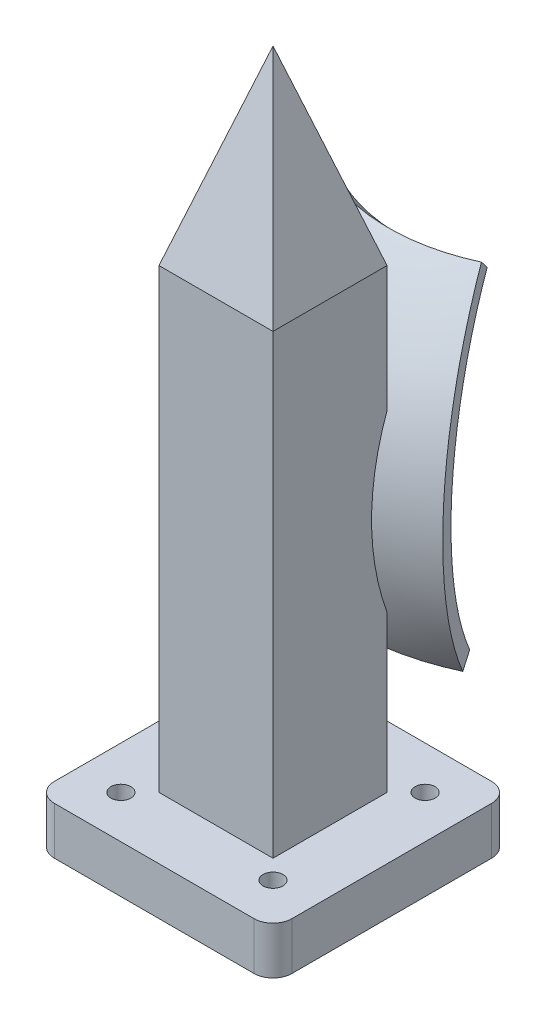
from build123d import *

# Parameters (mm, degrees)
SKETCH1_W                = 25
SKETCH1_H                = 25
BOSS_EXTRUDE1_DEPTH      = 5
SKETCH2_R                = 1.05
CUT_EXTRUDE1_DEPTH       = 5
FILLET1_R                = 2
SKETCH3_W                = 12
SKETCH3_H                = 12
SKETCH3_W_2              = 6
SKETCH3_H_2              = 6
BOSS_EXTRUDE2_DEPTH      = 48
SKETCH4_W                = 6
SKETCH4_H                = 6
CUT_EXTRUDE2_DEPTH       = 10
SKETCH5_W                = 12
SKETCH5_H                = 12
BOSS_EXTRUDE3_DEPTH      = 20
CUT_EXTRUDE3_DEPTH       = 20
CUT_EXTRUDE4_DEPTH       = 20
REVOLVE1_ANGLE           = 25
REVOLVE1_OTHER_WAY_ANGLE = 25


with BuildPart() as part:
    # Sketch1 → Boss-Extrude1 (new body)
    with BuildSketch(Plane(origin=(0, 0, 0), x_dir=(1, 0, 0), z_dir=(0, 1, 0))):
        with Locations((12.5, 12.5)):
            Rectangle(SKETCH1_W, SKETCH1_H)
    extrude(amount=BOSS_EXTRUDE1_DEPTH)

    # Sketch2 → Cut-Extrude1 (cut)
    with BuildSketch(Plane(origin=(0, 5, 0), x_dir=(1, 0, 0), z_dir=(0, 1, 0))):
        with Locations(Location((4.5, 4.5, 0), (0, 0, 270))):
            Circle(SKETCH2_R)
        with Locations(Location((20.5, 4.5, 0), (0, 0, 270))):
            Circle(SKETCH2_R)
        with Locations(Location((20.5, 20.5, 0), (0, 0, 270))):
            Circle(SKETCH2_R)
        with Locations(Location((4.5, 20.5, 0), (0, 0, 270))):
            Circle(SKETCH2_R)
    extrude(amount=-CUT_EXTRUDE1_DEPTH, mode=Mode.SUBTRACT)

    # Fillet1
    fillet1_edges = [part.edges().sort_by_distance(p)[0] for p in [
        (0, 2.5, -25),
        (25, 2.5, -25),
        (25, 2.5, 0),
        (0, 2.5, 0),
    ]]
    fillet(fillet1_edges, radius=FILLET1_R)

    # Sketch3 → Boss-Extrude2 (add)
    with BuildSketch(Plane(origin=(0, 5, 0), x_dir=(1, 0, 0), z_dir=(0, 1, 0))):
        with Locations((12.5, 12.5)):
            Rectangle(SKETCH3_W, SKETCH3_H)
        with Locations((12.5, 12.5)):
            Rectangle(SKETCH3_W_2, SKETCH3_H_2, mode=Mode.SUBTRACT)
    extrude(amount=BOSS_EXTRUDE2_DEPTH)

    # Sketch4 → Cut-Extrude2 (cut)
    with BuildSketch(Plane(origin=(0, 0, 0), x_dir=(-1, 0, 0), z_dir=(0, -1, 0))):
        with Locations((-12.5, 12.5)):
            Rectangle(SKETCH4_W, SKETCH4_H)
    extrude(amount=-CUT_EXTRUDE2_DEPTH, mode=Mode.SUBTRACT)

    # Sketch5 → Boss-Extrude3 (add)
    with BuildSketch(Plane(origin=(0, 53, 0), x_dir=(1, 0, 0), z_dir=(0, 1, 0))):
        with Locations((12.5, 12.5)):
            Rectangle(SKETCH5_W, SKETCH5_H)
    extrude(amount=BOSS_EXTRUDE3_DEPTH)

    # Sketch6 → Cut-Extrude3 (cut)
    with BuildSketch(Plane.XY.offset(-6.5)):
        Polygon((18.5, 73), (12.5, 73), (18.5, 53), align=None)
        Polygon((6.5, 53), (12.5, 73), (6.5, 73), align=None)
    extrude(amount=-CUT_EXTRUDE3_DEPTH, mode=Mode.SUBTRACT)

    # Sketch7 → Cut-Extrude4 (cut)
    with BuildSketch(Plane.ZY.offset(-6.5)):
        Polygon((-6.5, 73), (-6.5, 53), (-12.5, 73), align=None)
        Polygon((-18.5, 73), (-18.5, 53), (-12.5, 73), align=None)
    extrude(amount=-CUT_EXTRUDE4_DEPTH, mode=Mode.SUBTRACT)

    # Sketch8 → Revolve1 (revolve)
    with BuildSketch(Plane(origin=(12.5, 0, 0), x_dir=(0, 0, -1), z_dir=(1, 0, 0))):
        with BuildLine():
            ThreePointArc((24.627603923, 50.372343644), (16.394708904, 33.808356072), (20.558863125, 15.785979305))
            Line((20.558863125, 15.785979305), (22.064703847, 16.753815466))
            ThreePointArc((22.064703847, 16.753815466), (18.172495187, 33.599217247), (25.867730183, 49.081471856))
            Line((25.867730183, 49.081471856), (24.627603923, 50.372343644))
        make_face()
    revolve(axis=Axis((12.5, 54.79169199, -43.616981759), (0, -1, 0)), revolution_arc=REVOLVE1_ANGLE)

    # Sketch8 → Revolve1 other way (revolve)
    with BuildSketch(Plane(origin=(12.5, 0, 0), x_dir=(0, 0, -1), z_dir=(1, 0, 0))):
        with BuildLine():
            ThreePointArc((24.627603923, 50.372343644), (16.394708904, 33.808356072), (20.558863125, 15.785979305))
            Line((20.558863125, 15.785979305), (22.064703847, 16.753815466))
            ThreePointArc((22.064703847, 16.753815466), (18.172495187, 33.599217247), (25.867730183, 49.081471856))
            Line((25.867730183, 49.081471856), (24.627603923, 50.372343644))
        make_face()
    revolve(axis=Axis((12.5, 54.79169199, -43.616981759), (0, 1, 0)), revolution_arc=REVOLVE1_OTHER_WAY_ANGLE)


solid = part.part
